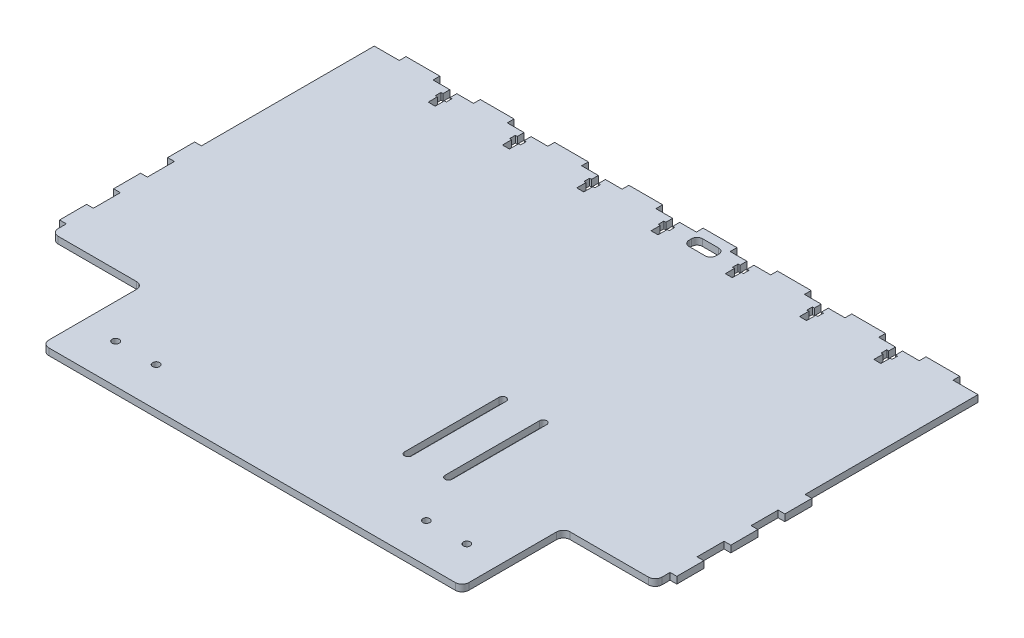
from build123d import *

# Parameters (mm, degrees)
ESBO_O1_W                 = 447
ESBO_O1_H                 = 314
RESSALTO_EXTRUS_O1_DEPTH  = 2.5
ESBO_O2_W                 = 25
ESBO_O2_H                 = 5
RESSALTO_EXTRUS_O2_DEPTH  = 5
PADR_O_LINEAR1_COUNT      = 8
PADR_O_LINEAR1_PITCH      = 55
ESBO_O3_W                 = 5.2
ESBO_O3_H                 = 5
ESBO_O3_W_2               = 8.1
ESBO_O3_H_2               = 4.2
ESBO_O3_H_3               = 6.8
CORTE_EXTRUS_O1_DEPTH     = 277.081962468
PADR_O_LINEAR2_COUNT      = 7
PADR_O_LINEAR2_PITCH      = 55
ESBO_O7_W                 = 68
ESBO_O7_H                 = 75
CORTE_EXTRUS_O2_DEPTH     = 10
ESBO_O8_R                 = 2.6
CORTE_EXTRUS_O3_DEPTH     = 277.081962468
FILETE1_R                 = 5
ESBO_O9_W                 = 20
ESBO_O9_H                 = 5
RESSALTO_EXTRUS_O3_DEPTH  = 5
PADR_O_LINEAR3_COUNT      = 3
PADR_O_LINEAR3_PITCH      = 40
ESPELHAR3_COPY_1_SKETCH_W = 20
ESPELHAR3_COPY_1_SKETCH_H = 5
ESPELHAR3_COPY_1_DEPTH    = 5
ESPELHAR3_COPY_2_SKETCH_W = 20
ESPELHAR3_COPY_2_SKETCH_H = 5
ESPELHAR3_COPY_2_DEPTH    = 5
CORTE_EXTRUS_O6_DEPTH     = 281.145051714
ESBO_O17_W                = 20
ESBO_O17_H                = 10
CORTE_EXTRUS_O10_DEPTH    = 281.145051714
FILETE2_R                 = 4


with BuildPart() as part:
    # Esboço1 → Ressalto-extrusão1 (new, symmetric)
    with BuildSketch(Plane(origin=(0, 0, 0), x_dir=(1, 0, 0), z_dir=(0, 1, 0))):
        Rectangle(ESBO_O1_W, ESBO_O1_H)
    extrude(amount=RESSALTO_EXTRUS_O1_DEPTH, both=True)

    # Esboço2 → Ressalto-extrusão2 (add)
    with BuildSketch(Plane(origin=(0, 0, -157), x_dir=(-1, 0, 0), z_dir=(0, 0, -1))):
        with Locations((-192.5, 0)):
            Rectangle(ESBO_O2_W, ESBO_O2_H)
    ressalto_extrus_o2 = extrude(amount=RESSALTO_EXTRUS_O2_DEPTH)

    # Padrão linear1: Ressalto-extrusão2 ×8
    with Locations(*[(-i * PADR_O_LINEAR1_PITCH, 0, 0) for i in range(1, PADR_O_LINEAR1_COUNT)]):
        add(ressalto_extrus_o2)

    # Esboço3 → Corte-extrusão1 (cut, through all)
    with BuildSketch(Plane(origin=(0, 2.5, 0), x_dir=(1, 0, 0), z_dir=(0, 1, 0))):
        with Locations((165, 154.5)):
            Rectangle(ESBO_O3_W, ESBO_O3_H)
        with Locations((165, 149.9)):
            Rectangle(ESBO_O3_W_2, ESBO_O3_H_2)
        with Locations((165, 144.4)):
            Rectangle(ESBO_O3_W, ESBO_O3_H_3)
    corte_extrus_o1 = extrude(amount=-CORTE_EXTRUS_O1_DEPTH, mode=Mode.SUBTRACT)

    # Padrão linear2: Corte-extrusão1 ×7
    with Locations(*[(-i * PADR_O_LINEAR2_PITCH, 0, 0) for i in range(1, PADR_O_LINEAR2_COUNT)]):
        add(corte_extrus_o1, mode=Mode.SUBTRACT)

    # Esboço7 → Corte-extrusão2 (cut)
    with BuildSketch(Plane(origin=(0, 2.5, 0), x_dir=(1, 0, 0), z_dir=(0, 1, 0))):
        with Locations((189.5, -119.5)):
            Rectangle(ESBO_O7_W, ESBO_O7_H)
    corte_extrus_o2 = extrude(amount=-CORTE_EXTRUS_O2_DEPTH, mode=Mode.SUBTRACT)

    # Esboço8 → Corte-extrusão3 (cut, through all)
    with BuildSketch(Plane(origin=(0, 2.5, 0), x_dir=(1, 0, 0), z_dir=(0, 1, 0))):
        with Locations(Location((130, -128, 0), (0, 0, 270))):
            Circle(ESBO_O8_R)
        with Locations(Location((100, -128, 0), (0, 0, 270))):
            Circle(ESBO_O8_R)
    corte_extrus_o3 = extrude(amount=-CORTE_EXTRUS_O3_DEPTH, mode=Mode.SUBTRACT)

    # Espelhar2: Corte-extrusão2, Corte-extrusão3 across plane
    add(corte_extrus_o2.mirror(Plane(origin=(0, 0, 0), x_dir=(0, 0, 1), z_dir=(1, 0, 0))), mode=Mode.SUBTRACT)
    add(corte_extrus_o3.mirror(Plane(origin=(0, 0, 0), x_dir=(0, 0, 1), z_dir=(1, 0, 0))), mode=Mode.SUBTRACT)

    # Filete1
    filete1_edges = [part.edges().sort_by_distance(p)[0] for p in [
        (223.5, 0, 82),
        (155.5, 0, 157),
        (155.5, 0, 82),
        (-223.5, 0, 82),
        (-155.5, 0, 82),
        (-155.5, 0, 157),
    ]]
    fillet(filete1_edges, radius=FILETE1_R)

    # Esboço9 → Ressalto-extrusão3 (add)
    with BuildSketch(Plane(origin=(223.5, 0, 0), x_dir=(0, 0, -1), z_dir=(1, 0, 0))):
        with Locations((-61, 0)):
            Rectangle(ESBO_O9_W, ESBO_O9_H)
    ressalto_extrus_o3 = extrude(amount=RESSALTO_EXTRUS_O3_DEPTH)

    # Padrão linear3: Ressalto-extrusão3 ×3
    with Locations(*[(0, 0, -i * PADR_O_LINEAR3_PITCH) for i in range(1, PADR_O_LINEAR3_COUNT)]):
        add(ressalto_extrus_o3)

    # Espelhar3: Ressalto-extrusão3 across plane
    add(ressalto_extrus_o3.mirror(Plane(origin=(0, 0, 0), x_dir=(0, 0, 1), z_dir=(1, 0, 0))))

    # Espelhar3 copy 1 sketch → Espelhar3 copy 1 (add)
    with BuildSketch(Plane(origin=(-223.5, 0, -40), x_dir=(0, 0, -1), z_dir=(-1, 0, 0))):
        with Locations((-61, 0)):
            Rectangle(ESPELHAR3_COPY_1_SKETCH_W, ESPELHAR3_COPY_1_SKETCH_H)
    extrude(amount=ESPELHAR3_COPY_1_DEPTH)

    # Espelhar3 copy 2 sketch → Espelhar3 copy 2 (add)
    with BuildSketch(Plane(origin=(-223.5, 0, -80), x_dir=(0, 0, -1), z_dir=(-1, 0, 0))):
        with Locations((-61, 0)):
            Rectangle(ESPELHAR3_COPY_2_SKETCH_W, ESPELHAR3_COPY_2_SKETCH_H)
    extrude(amount=ESPELHAR3_COPY_2_DEPTH)

    # Esboço12 → Corte-extrusão6 (cut, through all)
    with BuildSketch(Plane(origin=(0, 2.5, 0), x_dir=(1, 0, 0), z_dir=(0, 1, 0))):
        with BuildLine():
            Line((53.1, -22), (53.1, -92))
            ThreePointArc((53.1, -92), (50.5, -94.6), (47.9, -92))
            Line((47.9, -92), (47.9, -22))
            ThreePointArc((47.9, -22), (50.5, -19.4), (53.1, -22))
        make_face()
        with BuildLine():
            Line((77.9, -22), (77.9, -92))
            ThreePointArc((77.9, -92), (80.5, -94.6), (83.1, -92))
            Line((83.1, -92), (83.1, -22))
            ThreePointArc((83.1, -22), (80.5, -19.4), (77.9, -22))
        make_face()
    extrude(amount=-CORTE_EXTRUS_O6_DEPTH, mode=Mode.SUBTRACT)

    # Esboço17 → Corte-extrusão10 (cut, through all)
    with BuildSketch(Plane(origin=(0, 2.5, 0), x_dir=(1, 0, 0), z_dir=(0, 1, 0))):
        with Locations((27.5, 150)):
            Rectangle(ESBO_O17_W, ESBO_O17_H)
    extrude(amount=-CORTE_EXTRUS_O10_DEPTH, mode=Mode.SUBTRACT)

    # Filete2
    filete2_edges = [part.edges().sort_by_distance(p)[0] for p in [
        (37.5, 0, -155),
        (37.5, 0, -145),
        (17.5, 0, -145),
        (17.5, 0, -155),
    ]]
    fillet(filete2_edges, radius=FILETE2_R)


solid = part.part
